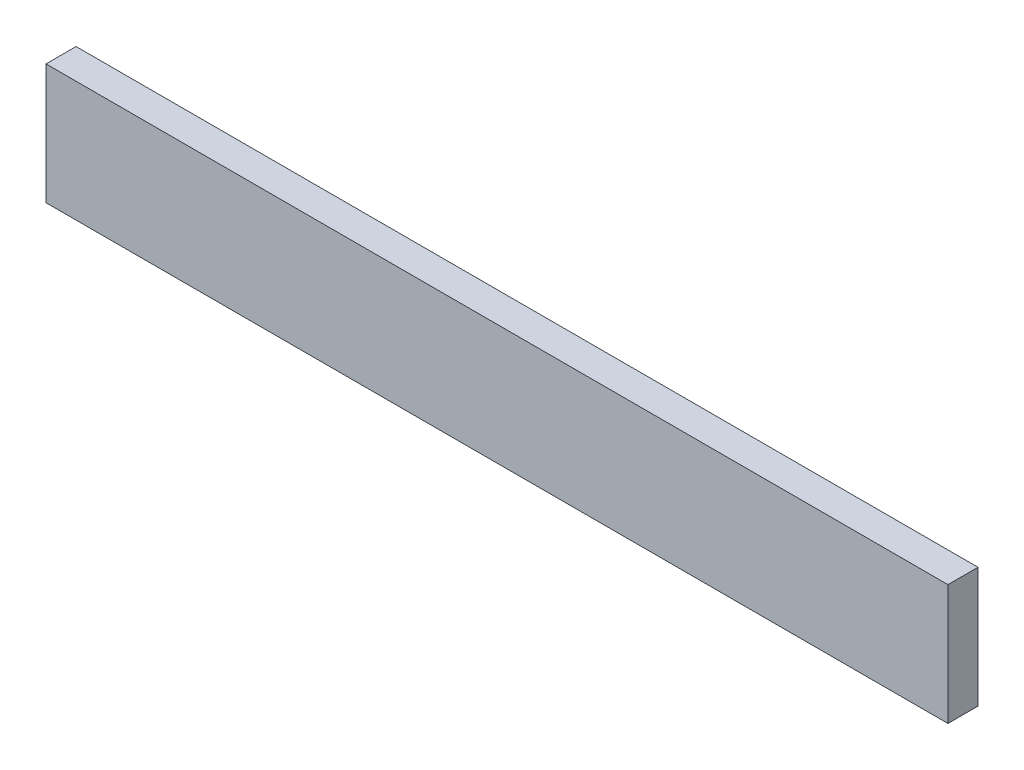
from build123d import *

# Parameters (mm, degrees)
SKETCH1_W           = 60
SKETCH1_H           = 8
BOSS_EXTRUDE1_DEPTH = 1


with BuildPart() as part:
    # Sketch1 → Boss-Extrude1 (new, symmetric)
    with BuildSketch(Plane.XY):
        Rectangle(SKETCH1_W, SKETCH1_H)
    extrude(amount=BOSS_EXTRUDE1_DEPTH, both=True)


solid = part.part
